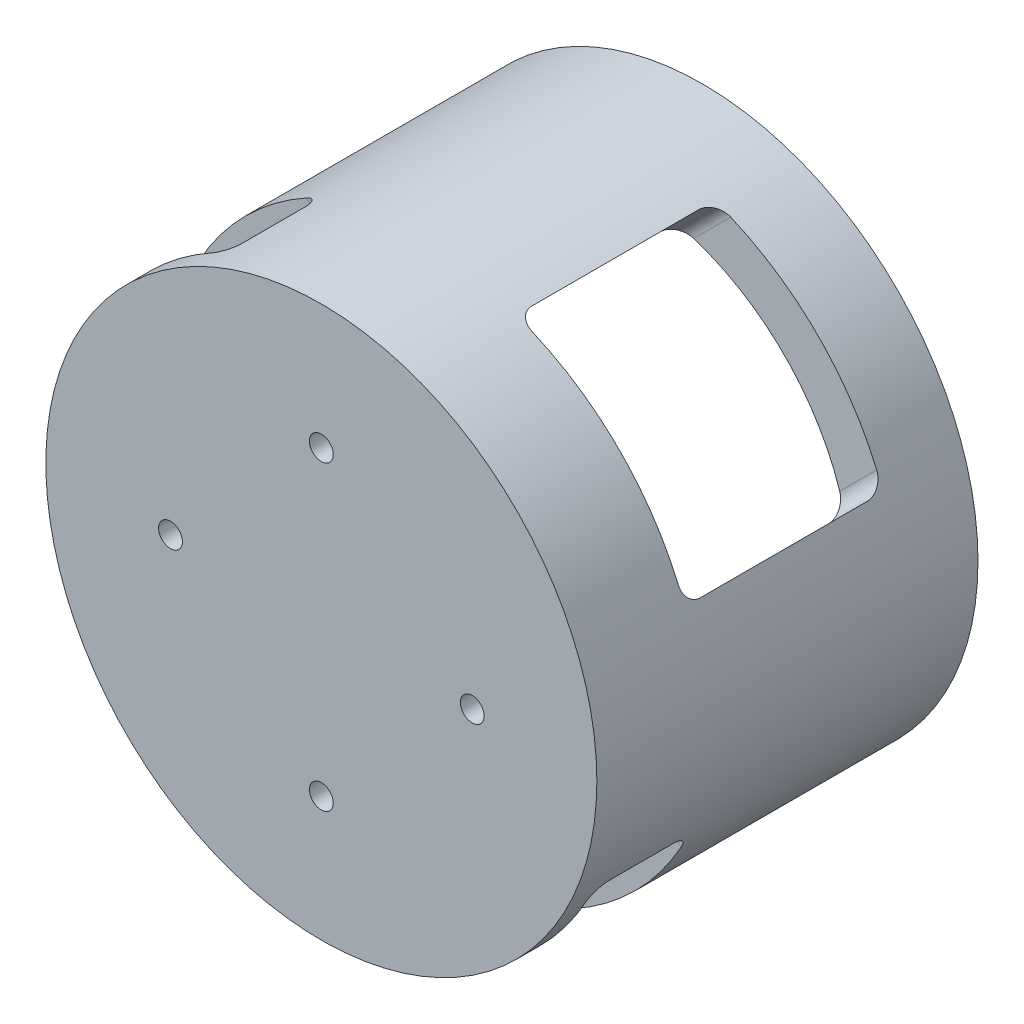
from build123d import *

# Parameters (mm, degrees)
SKETCH_1_R          = 28.7
SKETCH_1_R_2        = 1.5
EXTRUDE_1_DEPTH     = 3
EXTRUDE_START       = -48
SKETCH_2_R          = 34.7
SKETCH_2_R_2        = 28.7
EXTRUDE_2_DEPTH     = 48
SKETCH_3_W          = 12
SKETCH_3_H          = 23
CUT_EXTRUDE_1_DEPTH = 96.09443105
FILLET_1_R          = 2
SKETCH_4_W          = 30
SKETCH_4_H          = 25
CUT_EXTRUDE_2_DEPTH = 96.094431221
FILLET_2_R          = 2


with BuildPart() as part:
    # 草图1 → 凸台-拉伸1 (new body)
    with BuildSketch(Plane.XY):
        Circle(SKETCH_1_R)
        with Locations((0, 19)):
            Circle(SKETCH_1_R_2, mode=Mode.SUBTRACT)
        with Locations((19, 0)):
            Circle(SKETCH_1_R_2, mode=Mode.SUBTRACT)
        with Locations((0, -19)):
            Circle(SKETCH_1_R_2, mode=Mode.SUBTRACT)
        with Locations((-19, 0)):
            Circle(SKETCH_1_R_2, mode=Mode.SUBTRACT)
    extrude(amount=EXTRUDE_1_DEPTH)

    # 草图2 → 凸台-拉伸2 (add)
    with BuildSketch(Plane.XY.offset(3).offset(EXTRUDE_START)):
        Circle(SKETCH_2_R)
        Circle(SKETCH_2_R_2, mode=Mode.SUBTRACT)
    extrude(amount=EXTRUDE_2_DEPTH)

    # 草图3 → 切除-拉伸1 (cut, through all)
    with BuildSketch(Plane(origin=(-24.536605307, 24.536605307, 0), x_dir=(0, 0, 1), z_dir=(-0.7071067811865488, 0.7071067811865464, 0))):
        with Locations((-6, 0)):
            Rectangle(SKETCH_3_W, SKETCH_3_H)
    extrude(amount=-CUT_EXTRUDE_1_DEPTH, mode=Mode.SUBTRACT)

    # 圆角1
    fillet_1_edges = [part.edges().sort_by_distance(p)[0] for p in [
        (29.00347462, -12.740018652, -12),
        (-12.740018652, 29.00347462, -12),
        (29.00347462, -12.740018652, 0),
        (-12.740018652, 29.00347462, 0),
        (12.740018652, -29.00347462, 0),
        (-29.00347462, 12.740018652, 0),
        (-29.00347462, 12.740018652, -12),
        (12.740018652, -29.00347462, -12),
    ]]
    fillet(fillet_1_edges, radius=FILLET_1_R)

    # 草图4 → 切除-拉伸2 (cut, through all)
    with BuildSketch(Plane(origin=(24.536605307, 24.536605307, 0), x_dir=(0.7071067811865487, -0.7071067811865465, 0), z_dir=(0.7071067811865465, 0.7071067811865487, 0))):
        with Locations((0, 22.5)):
            Rectangle(SKETCH_4_W, SKETCH_4_H)
    extrude(amount=-CUT_EXTRUDE_2_DEPTH, mode=Mode.SUBTRACT)

    # 圆角2
    fillet_2_edges = [part.edges().sort_by_distance(p)[0] for p in [
        (-9.107024959, -30.320228395, -35),
        (30.320228395, 9.107024959, -35),
        (-9.107024959, -30.320228395, -10),
        (30.320228395, 9.107024959, -10),
        (-30.320228395, -9.107024959, -10),
        (9.107024959, 30.320228395, -10),
        (-30.320228395, -9.107024959, -35),
        (9.107024959, 30.320228395, -35),
    ]]
    fillet(fillet_2_edges, radius=FILLET_2_R)


solid = part.part
